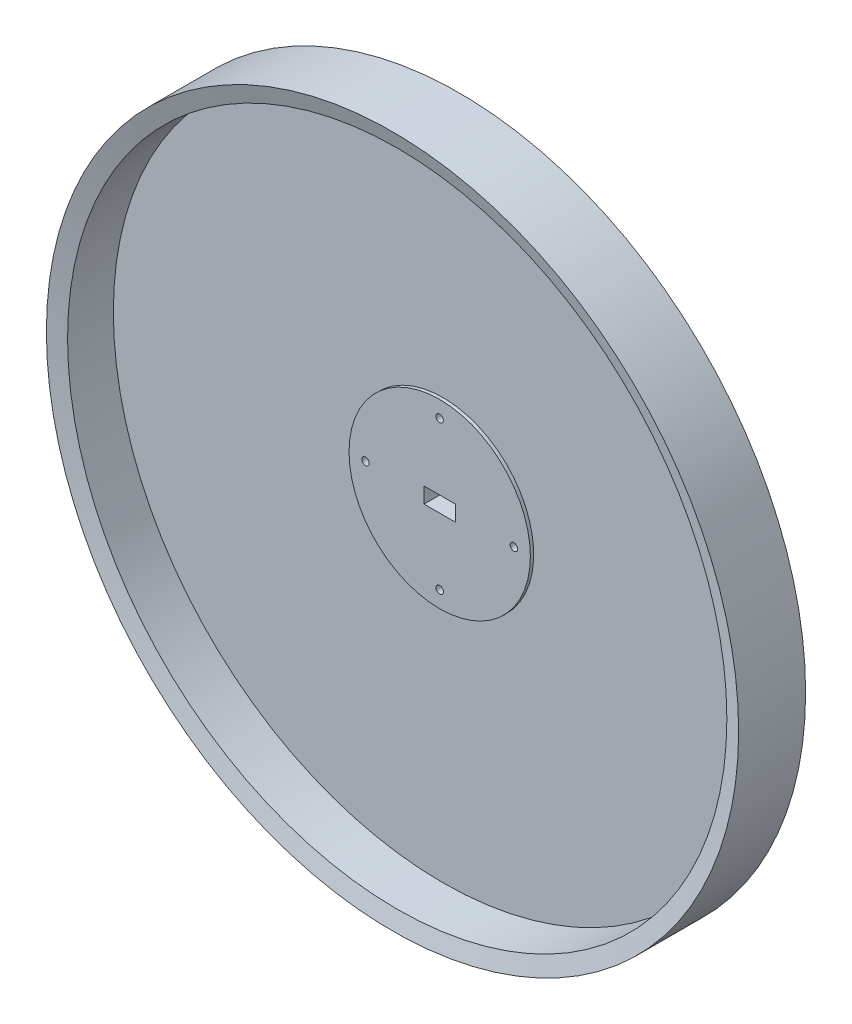
from build123d import *

# Parameters (mm, degrees)
CUT_EXTRUDE_1_DEPTH         = 299.559693571
CUT_EXTRUDE_1_DEPTH_BACK    = 299.559693571
SKETCH_2_W                  = 19
SKETCH_2_H                  = 9.5
SKETCH_3_R                  = 55
EXTRUDE_1_DEPTH             = 2
SKETCH_4_W                  = 19
SKETCH_4_H                  = 9.5
CUT_EXTRUDE_2_DEPTH         = 2
HOLE_WIZARD_M41_D           = 4.5
PATTERN_CIRCULAR_1_COUNT    = 4
HOLE_WIZARD_M42_D           = 4.5
HOLE_WIZARD_M42_DEPTH       = 10
HOLE_WIZARD_M42_CSINK_D     = 4.55
HOLE_WIZARD_M42_CSINK_ANGLE = 90
HOLE_WIZARD_M42_TIP         = 1.351936393


with BuildPart() as part:
    # Эскиз1 → Повернуть1 (revolve)
    with BuildSketch(Plane(origin=(0, 0, 0), x_dir=(1, 0, 0), z_dir=(0, 1, 0))):
        Polygon((0, 0), (200, 0), (200, -27.777777778), (210, -30.625), (210, 10), (0, 10), align=None)
    revolve(axis=Axis((0, 0, -10), (0, 0, 1)))

    # Эскиз2 → Вырез-Вытянуть1 (cut, two sides: drawn at the far end of the back side and taken through both)
    with BuildSketch(Plane.XY.offset(-CUT_EXTRUDE_1_DEPTH_BACK)):
        Rectangle(SKETCH_2_W, SKETCH_2_H)
    extrude(amount=CUT_EXTRUDE_1_DEPTH + CUT_EXTRUDE_1_DEPTH_BACK, mode=Mode.SUBTRACT)

    # Эскиз3 → Бобышка-Вытянуть1 (add)
    with BuildSketch(Plane.XY):
        Circle(SKETCH_3_R)
    extrude(amount=EXTRUDE_1_DEPTH)

    # Эскиз4 → Вырез-Вытянуть2 (cut)
    with BuildSketch(Plane.XY.offset(2)):
        Rectangle(SKETCH_4_W, SKETCH_4_H)
    extrude(amount=-CUT_EXTRUDE_2_DEPTH, mode=Mode.SUBTRACT)

    # Отверстие с зазором M41 (through all)
    with Locations(Plane(origin=(0, 45, 2), x_dir=(1, 0, 0), z_dir=(0, 0, 1))):
        with Locations((0, 0)):
            hole_wizard_m41 = Hole(HOLE_WIZARD_M41_D / 2)

    # Круговой массив1: Отверстие с зазором M41 ×4 about axis
    pattern_circular_1_axis = Axis((0, 0, 0), (0, 0, 1))
    for i in range(1, PATTERN_CIRCULAR_1_COUNT):
        add(hole_wizard_m41.rotate(pattern_circular_1_axis, i * 360 / PATTERN_CIRCULAR_1_COUNT), mode=Mode.SUBTRACT)

    # Отверстие с зазором M42
    with Locations(Plane(origin=(-14.5, 15, -10), x_dir=(-1, 0, 0), z_dir=(0, 0, -1))):
        with Locations((0, 0), (-29, 0), (-29, -30), (0, -30)):
            CounterSinkHole(HOLE_WIZARD_M42_D / 2, HOLE_WIZARD_M42_CSINK_D / 2, depth=HOLE_WIZARD_M42_DEPTH, counter_sink_angle=HOLE_WIZARD_M42_CSINK_ANGLE)
            with Locations((0, 0, -(HOLE_WIZARD_M42_DEPTH + HOLE_WIZARD_M42_TIP / 2))):  # 118° drill point
                Cone(0, HOLE_WIZARD_M42_D / 2, HOLE_WIZARD_M42_TIP, mode=Mode.SUBTRACT)


solid = part.part
